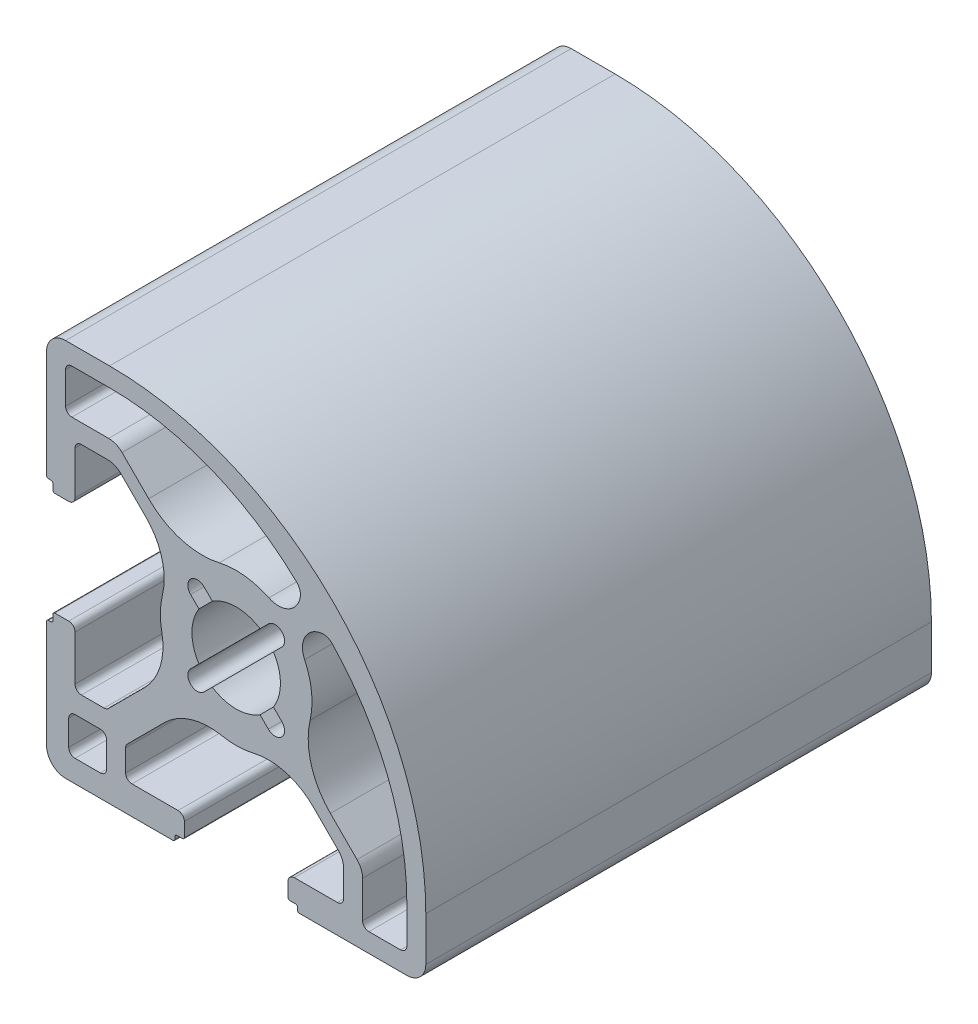
from build123d import *

# Parameters (mm, degrees)
Y_KSEKLIK_EKSTR_ZYON2_DEPTH = 40


with BuildPart() as part:
    # Çizim1 → Yükseklik-Ekstrüzyon2 (new body)
    with BuildSketch(Plane.XY):
        with BuildLine():
            ThreePointArc((-12.75, -4.6), (-12.896446609, -4.246446609), (-13.25, -4.1))
            Line((-13.25, -4.1), (-14.35, -4.1))
            ThreePointArc((-14.35, -4.1), (-14.456066017, -4.143933983), (-14.5, -4.25))
            Line((-14.5, -4.25), (-14.5, -4.7))
            ThreePointArc((-14.5, -4.7), (-14.543933983, -4.806066017), (-14.65, -4.85))
            Line((-14.65, -4.85), (-14.85, -4.85))
            ThreePointArc((-14.85, -4.85), (-14.956066017, -4.893933983), (-15, -5))
            Line((-15, -5), (-15, -13.5))
            ThreePointArc((-15, -13.5), (-14.560660172, -14.560660172), (-13.5, -15))
            Line((-13.5, -15), (-5, -15))
            ThreePointArc((-5, -15), (-4.893933983, -14.956066017), (-4.85, -14.85))
            Line((-4.85, -14.85), (-4.85, -14.65))
            ThreePointArc((-4.85, -14.65), (-4.806066017, -14.543933983), (-4.7, -14.5))
            Line((-4.7, -14.5), (-4.25, -14.5))
            ThreePointArc((-4.25, -14.5), (-4.143933983, -14.456066017), (-4.1, -14.35))
            Line((-4.1, -14.35), (-4.1, -13.25))
            ThreePointArc((-4.1, -13.25), (-4.246446609, -12.896446609), (-4.6, -12.75))
            Line((-4.6, -12.75), (-8.25, -12.75))
            ThreePointArc((-8.25, -12.75), (-8.603553391, -12.603553391), (-8.75, -12.25))
            Line((-8.75, -12.25), (-8.75, -10.548097039))
            ThreePointArc((-8.75, -10.548097039), (-8.711939766, -10.356755323), (-8.603553391, -10.194543648))
            Line((-8.603553391, -10.194543648), (-5.665324285, -7.256314543))
            ThreePointArc((-5.665324285, -7.256314543), (-3.584805828, -6.008237883), (-1.161703843, -5.88646279))
            ThreePointArc((-1.161703843, -5.88646279), (0.121501595, -5.998769654), (1.399107062, -5.834595053))
            ThreePointArc((1.399107062, -5.834595053), (3.922877314, -5.884663497), (6.100563519, -7.161223691))
            Line((6.100563519, -7.161223691), (8.060660172, -9.121320344))
            ThreePointArc((8.060660172, -9.121320344), (8.385819299, -9.607955367), (8.5, -10.181980515))
            Line((8.5, -10.181980515), (8.5, -12.25))
            ThreePointArc((8.5, -12.25), (8.353553391, -12.603553391), (8, -12.75))
            Line((8, -12.75), (4.6, -12.75))
            ThreePointArc((4.6, -12.75), (4.246446609, -12.896446609), (4.1, -13.25))
            Line((4.1, -13.25), (4.1, -14.35))
            ThreePointArc((4.1, -14.35), (4.143933983, -14.456066017), (4.25, -14.5))
            Line((4.25, -14.5), (4.7, -14.5))
            ThreePointArc((4.7, -14.5), (4.806066017, -14.543933983), (4.85, -14.65))
            Line((4.85, -14.65), (4.85, -14.85))
            ThreePointArc((4.85, -14.85), (4.893933983, -14.956066017), (5, -15))
            Line((5, -15), (13.5, -15))
            ThreePointArc((13.5, -15), (14.560660172, -14.560660172), (15, -13.5))
            Line((15, -13.5), (15, -10.020449132))
            ThreePointArc((15, -10.020449132), (7.671680118, 7.671680118), (-10.020449132, 15))
            Line((-10.020449132, 15), (-13.5, 15))
            ThreePointArc((-13.5, 15), (-14.560660172, 14.560660172), (-15, 13.5))
            Line((-15, 13.5), (-15, 5))
            ThreePointArc((-15, 5), (-14.956066017, 4.893933983), (-14.85, 4.85))
            Line((-14.85, 4.85), (-14.65, 4.85))
            ThreePointArc((-14.65, 4.85), (-14.543933983, 4.806066017), (-14.5, 4.7))
            Line((-14.5, 4.7), (-14.5, 4.25))
            ThreePointArc((-14.5, 4.25), (-14.456066017, 4.143933983), (-14.35, 4.1))
            Line((-14.35, 4.1), (-13.25, 4.1))
            ThreePointArc((-13.25, 4.1), (-12.896446609, 4.246446609), (-12.75, 4.6))
            Line((-12.75, 4.6), (-12.75, 8))
            ThreePointArc((-12.75, 8), (-12.603553391, 8.353553391), (-12.25, 8.5))
            Line((-12.25, 8.5), (-10.181980515, 8.5))
            ThreePointArc((-10.181980515, 8.5), (-9.607955367, 8.385819299), (-9.121320344, 8.060660172))
            Line((-9.121320344, 8.060660172), (-7.161223691, 6.100563519))
            ThreePointArc((-7.161223691, 6.100563519), (-5.884663497, 3.922877314), (-5.834595053, 1.399107062))
            ThreePointArc((-5.834595053, 1.399107062), (-5.998769654, 0.121501595), (-5.88646279, -1.161703843))
            ThreePointArc((-5.88646279, -1.161703843), (-6.008237883, -3.584805828), (-7.256314543, -5.665324285))
            Line((-7.256314543, -5.665324285), (-10.103553391, -8.512563133))
            ThreePointArc((-10.103553391, -8.512563133), (-10.265765065, -8.620949509), (-10.457106781, -8.659009742))
            Line((-10.457106781, -8.659009742), (-12.25, -8.659009742))
            ThreePointArc((-12.25, -8.659009742), (-12.603553391, -8.512563133), (-12.75, -8.159009742))
            Line((-12.75, -8.159009742), (-12.75, -4.6))
        make_face()
        with BuildLine():
            ThreePointArc((2.587626892, 5.413334191), (0.660394354, 5.963545866), (-1.340526419, 5.848332149))
            ThreePointArc((-1.340526419, 5.848332149), (-4.339403848, 5.930394105), (-6.923693524, 7.45402361))
            Line((-6.923693524, 7.45402361), (-9.030330086, 9.560660172))
            ThreePointArc((-9.030330086, 9.560660172), (-9.516965109, 9.885819299), (-10.090990258, 10))
            Line((-10.090990258, 10), (-13, 10))
            ThreePointArc((-13, 10), (-13.353553391, 10.146446609), (-13.5, 10.5))
            Line((-13.5, 10.5), (-13.5, 13))
            ThreePointArc((-13.5, 13), (-13.353553391, 13.353553391), (-13, 13.5))
            Line((-13, 13.5), (-10.020449132, 13.5))
            ThreePointArc((-10.020449132, 13.5), (-2.058398163, 11.971373122), (4.771466284, 7.602859941))
            ThreePointArc((4.771466284, 7.602859941), (5.02983183, 7.200254947), (5.071628638, 6.723708451))
            ThreePointArc((5.071628638, 6.723708451), (4.158873557, 5.444388853), (2.587626892, 5.413334191))
        make_face(mode=Mode.SUBTRACT)
        with BuildLine():
            ThreePointArc((5.848332149, -1.340526419), (5.963545866, 0.660394354), (5.413334191, 2.587626892))
            ThreePointArc((5.413334191, 2.587626892), (5.444388853, 4.158873557), (6.723708451, 5.071628638))
            ThreePointArc((6.723708451, 5.071628638), (7.200254947, 5.02983183), (7.602859941, 4.771466284))
            ThreePointArc((7.602859941, 4.771466284), (11.971373122, -2.058398163), (13.5, -10.020449132))
            Line((13.5, -10.020449132), (13.5, -13))
            ThreePointArc((13.5, -13), (13.353553391, -13.353553391), (13, -13.5))
            Line((13, -13.5), (10.5, -13.5))
            ThreePointArc((10.5, -13.5), (10.146446609, -13.353553391), (10, -13))
            Line((10, -13), (10, -10.090990258))
            ThreePointArc((10, -10.090990258), (9.885819299, -9.516965109), (9.560660172, -9.030330086))
            Line((9.560660172, -9.030330086), (7.45402361, -6.923693524))
            ThreePointArc((7.45402361, -6.923693524), (5.930394105, -4.339403848), (5.848332149, -1.340526419))
        make_face(mode=Mode.SUBTRACT)
        with BuildLine():
            Line((-13.25, -12.75), (-13.25, -10.75))
            ThreePointArc((-13.25, -10.75), (-13.103553391, -10.396446609), (-12.75, -10.25))
            Line((-12.75, -10.25), (-10.75, -10.25))
            ThreePointArc((-10.75, -10.25), (-10.396446609, -10.396446609), (-10.25, -10.75))
            Line((-10.25, -10.75), (-10.25, -12.75))
            ThreePointArc((-10.25, -12.75), (-10.396446609, -13.103553391), (-10.75, -13.25))
            Line((-10.75, -13.25), (-12.75, -13.25))
            ThreePointArc((-12.75, -13.25), (-13.103553391, -13.103553391), (-13.25, -12.75))
        make_face(mode=Mode.SUBTRACT)
        with BuildLine():
            ThreePointArc((2.545584412, 3.606244584), (3.075914498, 3.825914498), (3.606244584, 3.606244584))
            ThreePointArc((3.606244584, 3.606244584), (3.825914498, 3.075914498), (3.606244584, 2.545584412))
            Line((3.606244584, 2.545584412), (2.947715037, 1.887054865))
            ThreePointArc((2.947715037, 1.887054865), (3.5, 0), (2.947715037, -1.887054865))
            Line((2.947715037, -1.887054865), (3.606244584, -2.545584412))
            ThreePointArc((3.606244584, -2.545584412), (3.606244584, -3.606244584), (2.545584412, -3.606244584))
            Line((2.545584412, -3.606244584), (1.887054865, -2.947715037))
            ThreePointArc((1.887054865, -2.947715037), (0, -3.5), (-1.887054865, -2.947715037))
            Line((-1.887054865, -2.947715037), (-2.545584412, -3.606244584))
            ThreePointArc((-2.545584412, -3.606244584), (-3.606244584, -3.606244584), (-3.606244584, -2.545584412))
            Line((-3.606244584, -2.545584412), (-2.947715037, -1.887054865))
            ThreePointArc((-2.947715037, -1.887054865), (-3.5, 0), (-2.947715037, 1.887054865))
            Line((-2.947715037, 1.887054865), (-3.606244584, 2.545584412))
            ThreePointArc((-3.606244584, 2.545584412), (-3.606244584, 3.606244584), (-2.545584412, 3.606244584))
            Line((-2.545584412, 3.606244584), (-1.887054865, 2.947715037))
            ThreePointArc((-1.887054865, 2.947715037), (0, 3.5), (1.887054865, 2.947715037))
            Line((1.887054865, 2.947715037), (2.545584412, 3.606244584))
        make_face(mode=Mode.SUBTRACT)
    extrude(amount=-Y_KSEKLIK_EKSTR_ZYON2_DEPTH)


solid = part.part
